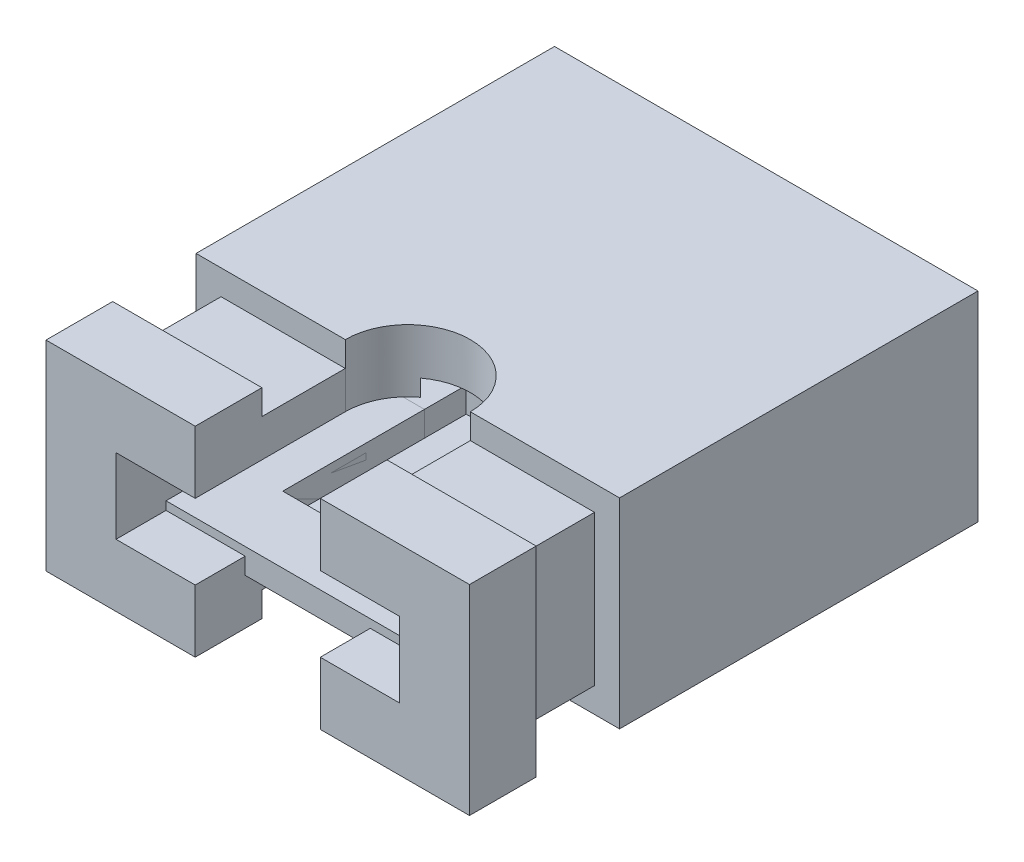
from build123d import *

# Parameters (mm, degrees)
SKETCH1_W           = 5.08
SKETCH1_H           = 2.4
SKETCH1_W_2         = 3.799999998
SKETCH1_H_2         = 1.299999999
BOSS_EXTRUDE1_DEPTH = 4.3
SKETCH3_R           = 0.75
CUT_EXTRUDE2_DEPTH  = 6.540902454
BOSS_EXTRUDE2_DEPTH = 1
BOSS_EXTRUDE3_DEPTH = 0.8
BOSS_EXTRUDE4_DEPTH = 2.4
CUT_EXTRUDE4_DEPTH  = 7.861785482
BOSS_EXTRUDE5_DEPTH = 3
BOSS_EXTRUDE8_DEPTH = 2.5
SKETCH14_W          = 2.199999998
SKETCH14_H          = 2.2
CUT_EXTRUDE5_DEPTH  = 0.3


with BuildPart() as part:
    # Sketch1 → Boss-Extrude1 (new body)
    with BuildSketch(Plane.XY):
        Rectangle(SKETCH1_W, SKETCH1_H)
        Rectangle(SKETCH1_W_2, SKETCH1_H_2, mode=Mode.SUBTRACT)
    extrude(amount=BOSS_EXTRUDE1_DEPTH)

    # Sketch3 → Cut-Extrude2 (cut, through all)
    with BuildSketch(Plane(origin=(0, 1.2, 0), x_dir=(1, 0, 0), z_dir=(0, 1, 0))):
        with Locations((0, -4.3)):
            Circle(SKETCH3_R)
    extrude(amount=-CUT_EXTRUDE2_DEPTH, mode=Mode.SUBTRACT)

    # Sketch6 → Boss-Extrude2 (add)
    with BuildSketch(Plane.XY.offset(4.3)):
        Polygon((-0.75, 0.9), (-0.75, 0.649999999), (-1.899999999, 0.649999999), (-1.899999999, -0.65), (-0.75, -0.65), (-0.75, -0.9), (-2.24, -0.9), (-2.24, 0.9), align=None)
        Polygon((2.24, 0.9), (2.24, -0.9), (0.75, -0.9), (0.75, -0.65), (1.899999999, -0.65), (1.899999999, 0.649999999), (0.75, 0.649999999), (0.75, 0.9), align=None)
    extrude(amount=BOSS_EXTRUDE2_DEPTH)

    # Sketch7 → Boss-Extrude3 (add)
    with BuildSketch(Plane.XY.offset(5.3)):
        Polygon((-0.75, 1.2), (-0.75, 0.9), (-0.75, 0.649999999), (-1.899999999, 0.649999999), (-1.899999999, -0.65), (-0.75, -0.65), (-0.75, -0.9), (-0.75, -1.2), (-2.54, -1.2), (-2.54, 1.2), align=None)
        Polygon((0.75, -0.9), (0.75, -1.2), (2.54, -1.2), (2.54, 1.2), (0.75, 1.2), (0.75, 0.9), (0.75, 0.649999999), (1.899999999, 0.649999999), (1.899999999, -0.65), (0.75, -0.65), align=None)
    extrude(amount=BOSS_EXTRUDE3_DEPTH)

    # Sketch9 → Boss-Extrude4 (add)
    with BuildSketch(Plane.XY.offset(6.1)):
        Polygon((0.75, 0.649999999), (1.899999999, 0.649999999), (1.899999999, -0.65), (0.75, -0.65), (-0.75, -0.65), (-1.899999999, -0.65), (-1.899999999, 0.649999999), (-0.75, 0.649999999), align=None)
        Polygon((-0.75, -0.45), (-1.699999999, -0.45), (-1.699999999, 0.449999999), (-0.75, 0.449999999), (0.75, 0.449999999), (1.699999999, 0.449999999), (1.699999999, -0.45), (0.75, -0.45), align=None, mode=Mode.SUBTRACT)
    extrude(amount=-BOSS_EXTRUDE4_DEPTH)

    # Sketch10 → Cut-Extrude4 (cut, through all)
    with BuildSketch(Plane(origin=(0, 0.649999999, 0), x_dir=(1, 0, 0), z_dir=(0, 1, 0))):
        with BuildLine():
            Line((0.75, -6.1), (0.75, -4.3))
            ThreePointArc((0.75, -4.3), (0.670820393, -3.964589803), (0.45, -3.7))
            ThreePointArc((0.45, -3.7), (0, -3.55), (-0.45, -3.7))
            ThreePointArc((-0.45, -3.7), (-0.670820393, -3.964589803), (-0.75, -4.3))
            Line((-0.75, -4.3), (-0.75, -6.1))
            Line((-0.75, -6.1), (0.75, -6.1))
        make_face()
    extrude(amount=-CUT_EXTRUDE4_DEPTH, mode=Mode.SUBTRACT)


with BuildPart() as body_2:
    # Sketch12 → Boss-Extrude5 (new body)
    with BuildSketch(Plane(origin=(0, 0, 0), x_dir=(-1, 0, 0), z_dir=(0, 0, -1))):
        Polygon((1.899999999, 0.649999999), (1.899999999, -0.65), (-1.899999999, -0.65), (-1.899999999, 0.649999999), (-1.599999999, 0.649999999), (-1.599999999, -0.35), (1.599999999, -0.35), (1.599999999, 0.649999999), align=None)
    extrude(amount=-BOSS_EXTRUDE5_DEPTH)


with BuildPart() as body_3:
    # Sketch13 → Boss-Extrude8 (new body)
    with BuildSketch(Plane.XY.offset(3)):
        Polygon((1.899999999, -0.65), (-1.899999999, -0.65), (-1.899999999, -0.35), (-1.599999999, -0.35), (1.599999999, -0.35), (1.899999999, -0.35), align=None)
    extrude(amount=BOSS_EXTRUDE8_DEPTH)


with BuildPart() as cut_extrude5_tool:
    # Sketch14 → Cut-Extrude5 (new body)
    with BuildSketch(Plane(origin=(0, -0.35, 0), x_dir=(1, 0, 0), z_dir=(0, 1, 0))):
        with Locations((0, -3.6)):
            Rectangle(SKETCH14_W, SKETCH14_H)
    extrude(amount=-CUT_EXTRUDE5_DEPTH)


with BuildPart() as part_1:
    add(part.part)

    # Cut-Extrude5: cut by cut_extrude5_tool
    add(cut_extrude5_tool.part, mode=Mode.SUBTRACT)


with BuildPart() as body_2_1:
    add(body_2.part)

    # Cut-Extrude5: cut by cut_extrude5_tool
    add(cut_extrude5_tool.part, mode=Mode.SUBTRACT)


with BuildPart() as body_3_1:
    add(body_3.part)

    # Cut-Extrude5: cut by cut_extrude5_tool
    add(cut_extrude5_tool.part, mode=Mode.SUBTRACT)


solid = Compound([part_1.part, body_2_1.part, body_3_1.part])
